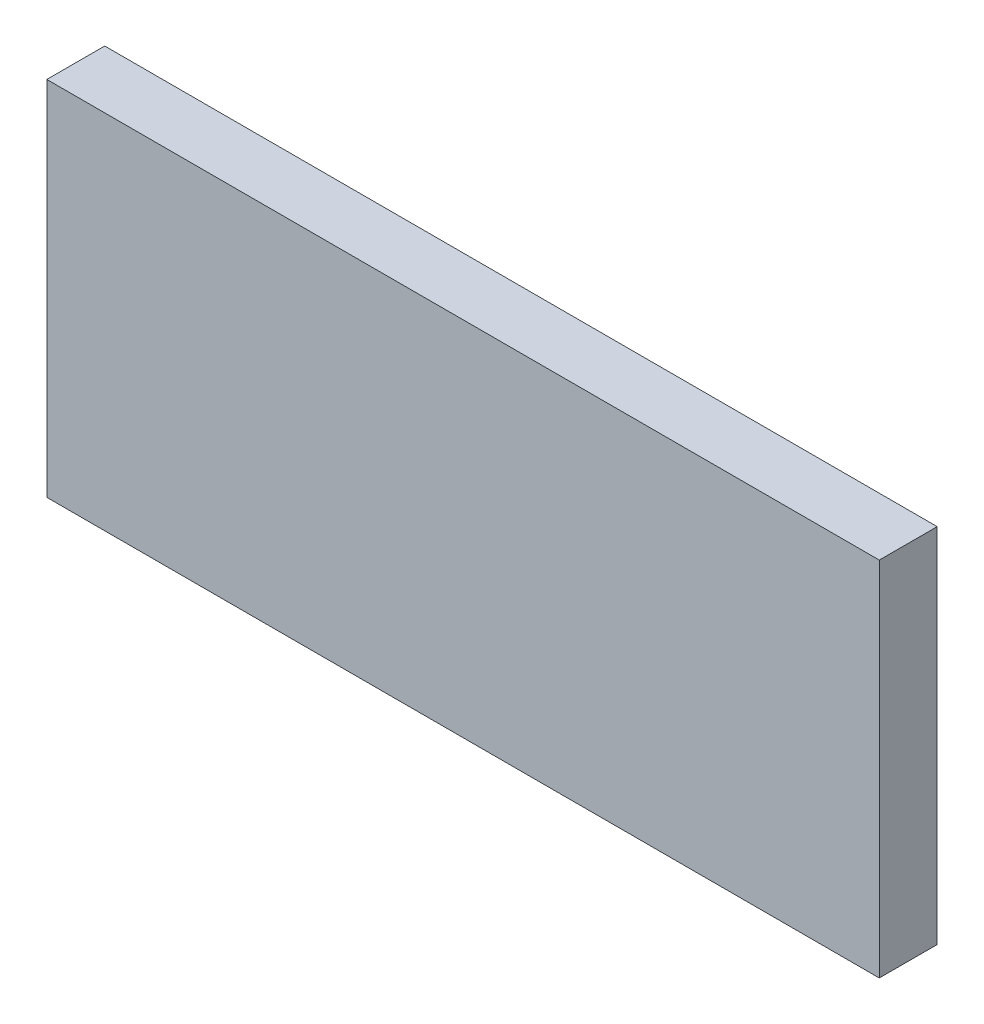
from build123d import *

# Parameters (mm, degrees)
SKETCH_1_W      = 230
SKETCH_1_H      = 100
EXTRUDE_1_DEPTH = 16


with BuildPart() as part:
    # 草图1 → 凸台-拉伸1 (new body)
    with BuildSketch(Plane.XY):
        Rectangle(SKETCH_1_W, SKETCH_1_H)
    extrude(amount=EXTRUDE_1_DEPTH)


solid = part.part
